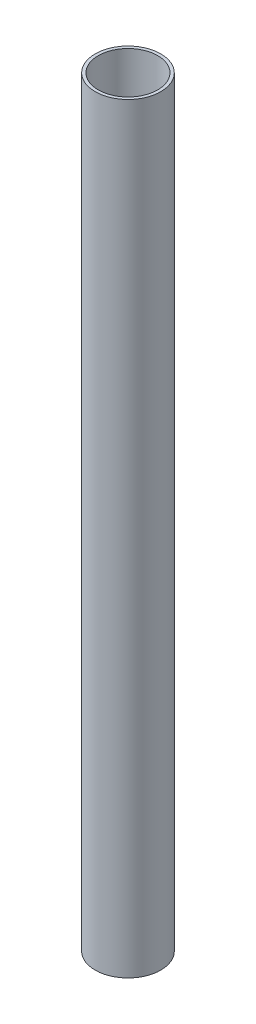
from build123d import *

# Parameters (mm, degrees)
SKETCH1_R           = 0.56
SKETCH1_R_2         = 0.508
BOSS_EXTRUDE1_DEPTH = 13


with BuildPart() as part:
    # Sketch1 → Boss-Extrude1 (new body)
    with BuildSketch(Plane(origin=(0, 0, 0), x_dir=(1, 0, 0), z_dir=(0, 1, 0))):
        with Locations(Location((0, 0, 0), (0, 0, 270))):
            Circle(SKETCH1_R)
        with Locations(Location((0, 0, 0), (0, 0, 270))):
            Circle(SKETCH1_R_2, mode=Mode.SUBTRACT)
    extrude(amount=BOSS_EXTRUDE1_DEPTH)


solid = part.part
